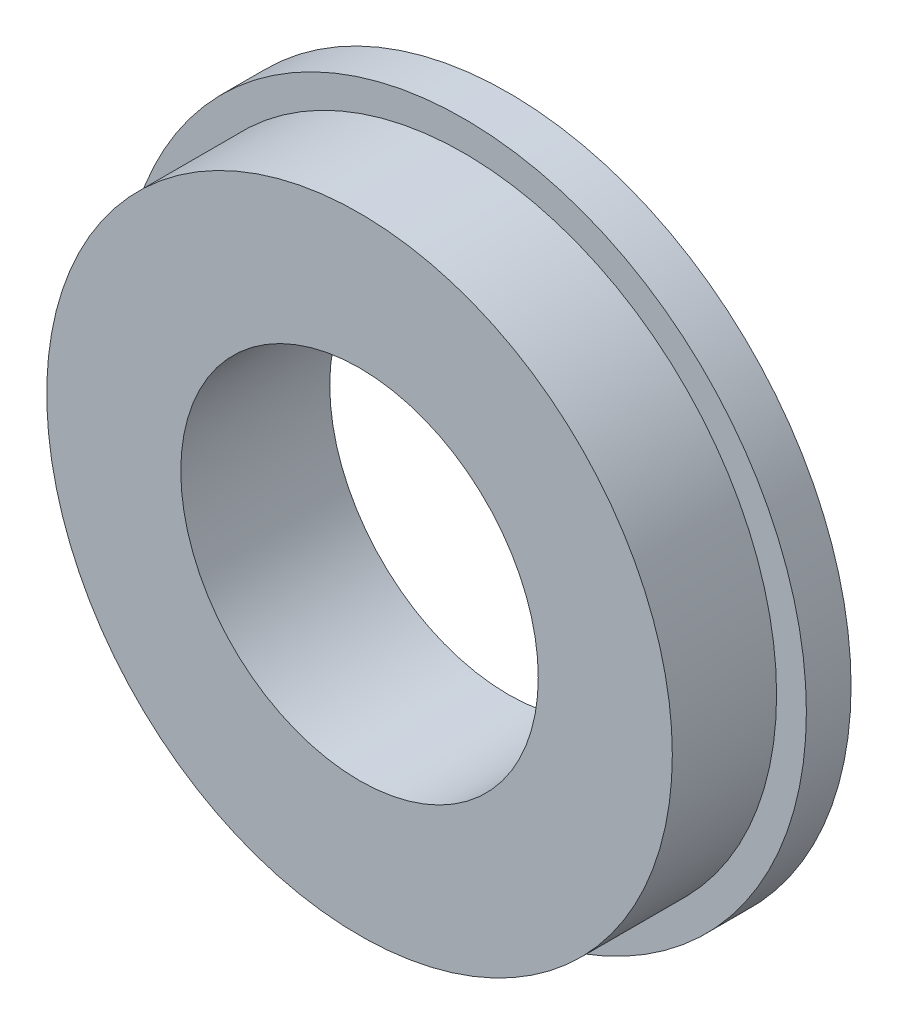
from build123d import *

# Parameters (mm, degrees)
SKETCH_1_R          = 11.5
EXTRUDE_1_DEPTH     = 1.5
SKETCH_2_R          = 10.5
EXTRUDE_2_DEPTH     = 3.5
SKETCH_3_R          = 6
CUT_EXTRUDE_1_DEPTH = 18.014699527


with BuildPart() as part:
    # 草图1 → 凸台-拉伸1 (new body)
    with BuildSketch(Plane.XY):
        Circle(SKETCH_1_R)
    extrude(amount=EXTRUDE_1_DEPTH)

    # 草图2 → 凸台-拉伸2 (add)
    with BuildSketch(Plane.XY.offset(1.5)):
        Circle(SKETCH_2_R)
    extrude(amount=EXTRUDE_2_DEPTH)

    # 草图3 → 切除-拉伸1 (cut, through all)
    with BuildSketch(Plane.XY.offset(5)):
        Circle(SKETCH_3_R)
    extrude(amount=-CUT_EXTRUDE_1_DEPTH, mode=Mode.SUBTRACT)


solid = part.part
